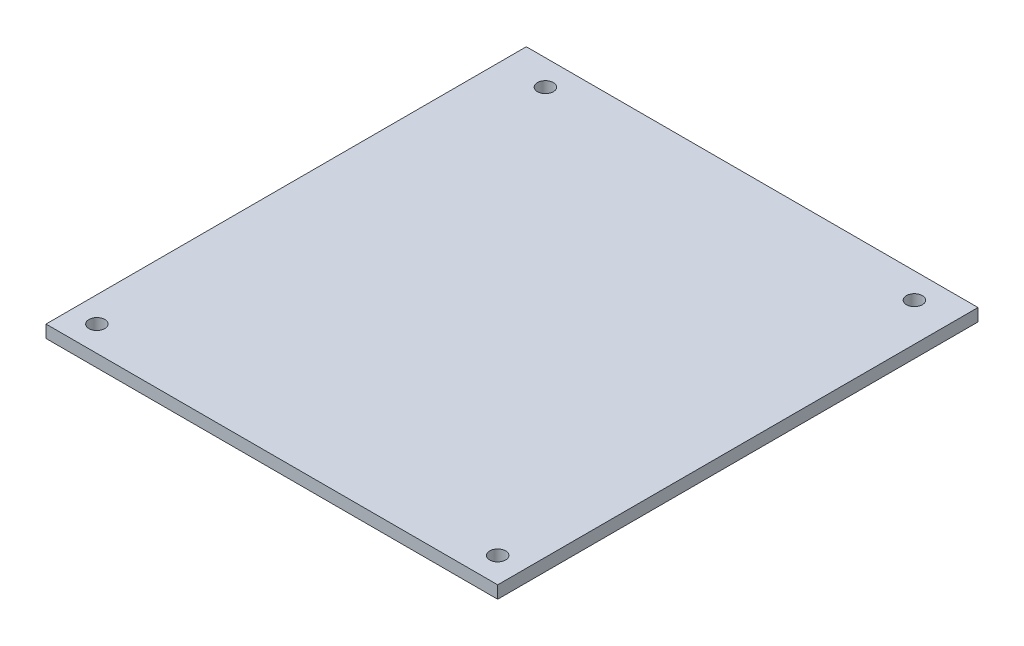
from build123d import *

# Parameters (mm, degrees)
SKETCH1_W           = 90.17
SKETCH1_H           = 95.885
BOSS_EXTRUDE1_DEPTH = 2.5
SKETCH2_R           = 1.5875
CUT_EXTRUDE1_DEPTH  = 2.5


with BuildPart() as part:
    # Sketch1 → Boss-Extrude1 (new body)
    with BuildSketch(Plane(origin=(0, 0, 0), x_dir=(1, 0, 0), z_dir=(0, 1, 0))):
        Rectangle(SKETCH1_W, SKETCH1_H)
    extrude(amount=BOSS_EXTRUDE1_DEPTH)

    # Sketch2 → Cut-Extrude1 (cut)
    with BuildSketch(Plane(origin=(0, 2.5, 0), x_dir=(1, 0, 0), z_dir=(0, 1, 0))):
        with Locations(Location((-40.005, -42.8625, 0), (0, 0, 270))):
            Circle(SKETCH2_R)
        with Locations(Location((-36.195, 42.8625, 0), (0, 0, 270))):
            Circle(SKETCH2_R)
        with Locations(Location((37.465, 42.8625, 0), (0, 0, 270))):
            Circle(SKETCH2_R)
        with Locations(Location((40.005, -42.8625, 0), (0, 0, 270))):
            Circle(SKETCH2_R)
    extrude(amount=-CUT_EXTRUDE1_DEPTH, mode=Mode.SUBTRACT)


solid = part.part
